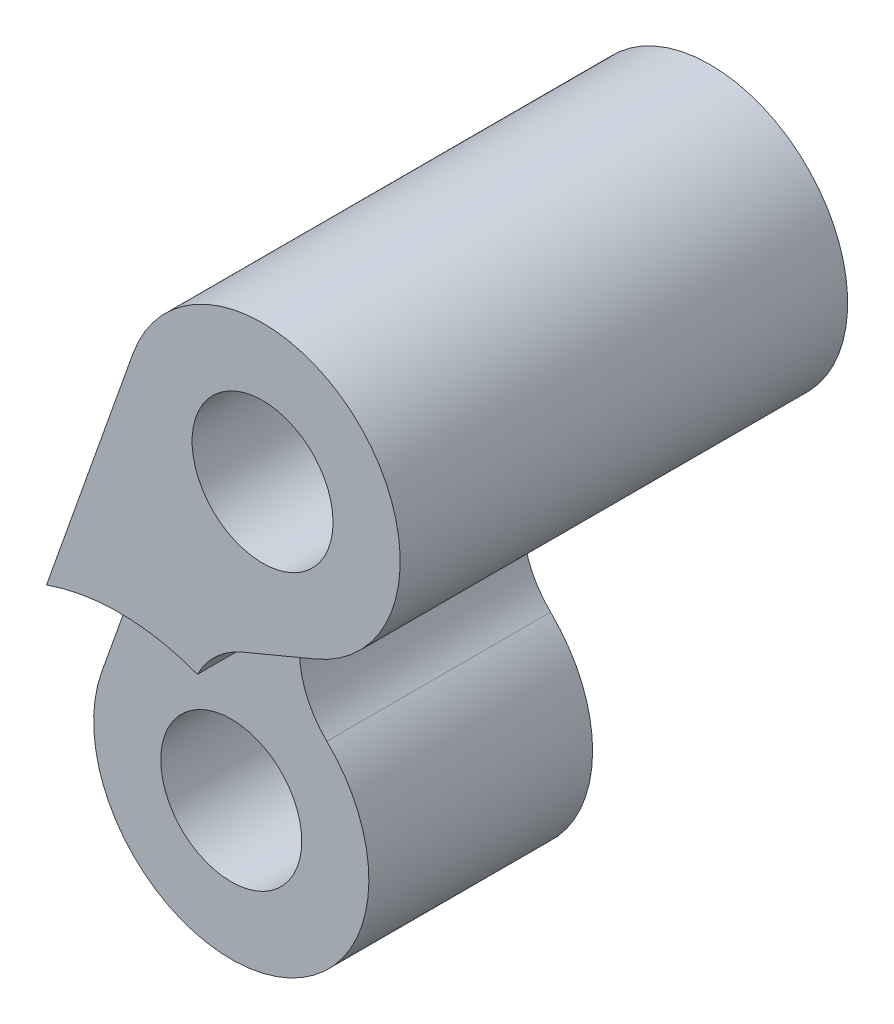
from build123d import *

# Parameters (mm, degrees)
SKETCH1_R           = 1.575
BOSS_EXTRUDE1_DEPTH = 5
SKETCH2_R           = 4.88448764
CUT_EXTRUDE1_DEPTH  = 2.5


with BuildPart() as part:
    # Sketch1 → Boss-Extrude1 (new, symmetric)
    with BuildSketch(Plane.XY):
        with BuildLine():
            Line((1.186113957, -2.83703343), (-0.446593535, -3.519639818))
            ThreePointArc((-0.446593535, -3.519639818), (-1.640687739, -4.995254909), (-1.064164547, -6.803823921))
            ThreePointArc((-1.064164547, -6.803823921), (-2.49573113, -12.009536189), (-6.097709737, -7.987773738))
            Line((-6.097709737, -7.987773738), (-2.8979158, 1.028449811))
            ThreePointArc((-2.8979158, 1.028449811), (2.113777793, 2.233286466), (1.186113957, -2.83703343))
        make_face()
        Circle(SKETCH1_R, mode=Mode.SUBTRACT)
        with Locations((-3.199793936, -9.016223549)):
            Circle(SKETCH1_R, mode=Mode.SUBTRACT)
    extrude(amount=BOSS_EXTRUDE1_DEPTH, both=True)

    # Sketch2 → Cut-Extrude1 (cut)
    with BuildSketch(Plane.XY.offset(5)):
        with Locations((-3.199793936, -9.016223549)):
            Circle(SKETCH2_R)
    cut_extrude1 = extrude(amount=-CUT_EXTRUDE1_DEPTH, mode=Mode.SUBTRACT)

    # Mirror1: Cut-Extrude1 across plane
    add(cut_extrude1.mirror(Plane.XY), mode=Mode.SUBTRACT)


solid = part.part
